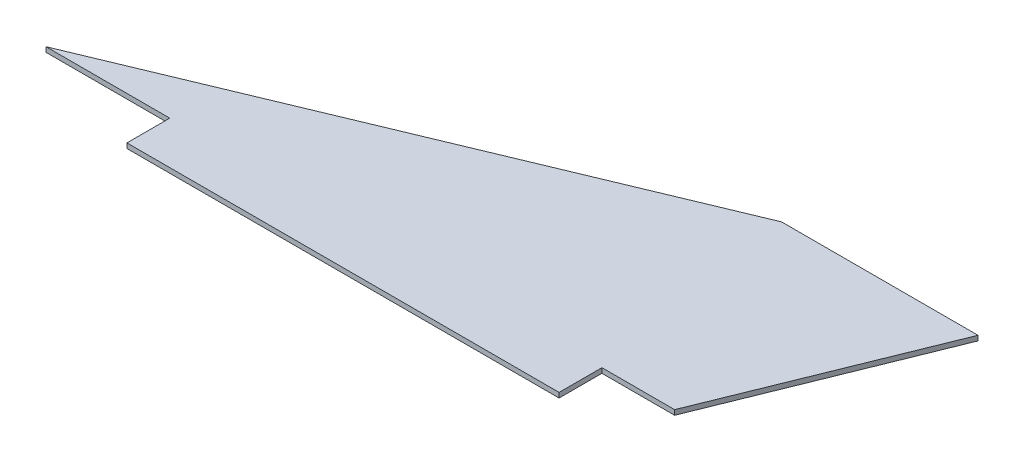
from build123d import *

# Parameters (mm, degrees)
BOSS_EXTRUDE1_DEPTH = 1.5875


with BuildPart() as part:
    # Sketch1 → Boss-Extrude1 (new, symmetric)
    with BuildSketch(Plane(origin=(0, 0, 0), x_dir=(1, 0, 0), z_dir=(0, 1, 0))):
        Polygon((0, 0), (80.01, 0), (80.01, -27.686), (359.41, -27.686), (359.41, 0), (406.4, 0), (462.842463749, 139.7), (335.842463749, 139.7), align=None)
    extrude(amount=BOSS_EXTRUDE1_DEPTH, both=True)


solid = part.part
